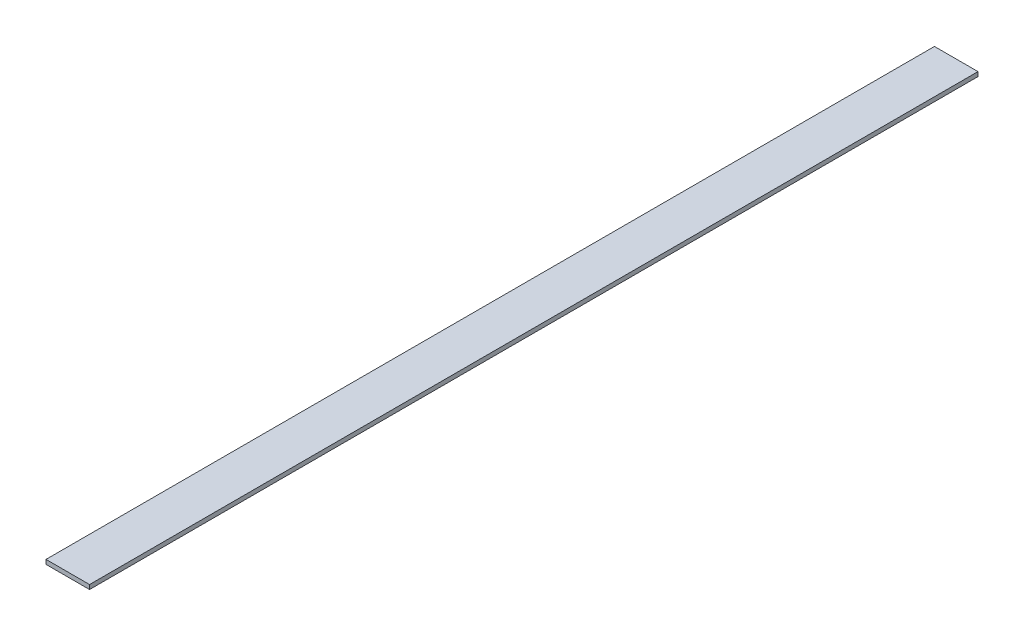
from build123d import *

# Parameters (mm, degrees)
BOSS_EXTRUDE1_DEPTH = 1020


with BuildPart() as part:
    # Sketch1 → Boss-Extrude1 (new body)
    with BuildSketch(Plane.XY):
        Polygon((5, 0), (55, 0), (55, 5), (25, 5), (15, 5), (5, 5), align=None)
    extrude(amount=BOSS_EXTRUDE1_DEPTH)


solid = part.part
